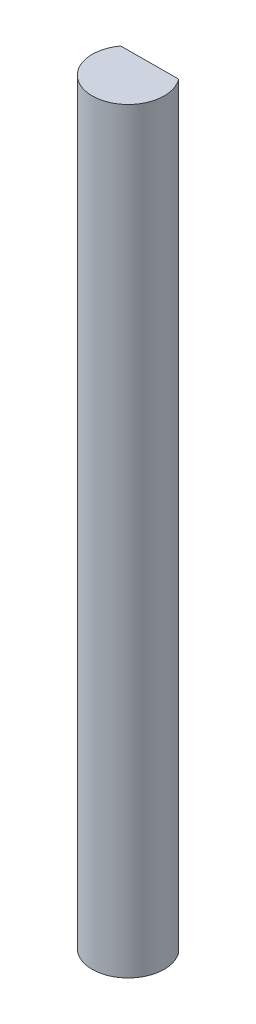
from build123d import *

# Parameters (mm, degrees)
SKETCH1_R           = 3.175
BOSS_EXTRUDE1_DEPTH = 41.275
CUT_EXTRUDE5_DEPTH  = 83.672025196
CUT_EXTRUDE8_DEPTH  = 15.875


with BuildPart() as part:
    # Sketch1 → Boss-Extrude1 (new, symmetric)
    with BuildSketch(Plane(origin=(0, 0, 0), x_dir=(1, 0, 0), z_dir=(0, 1, 0))):
        with Locations(Location((0, 0, 0), (0, 0, 270))):
            Circle(SKETCH1_R)
    extrude(amount=BOSS_EXTRUDE1_DEPTH, both=True)

    # Sketch2 → Cut-Extrude5 (cut, through all)
    with BuildSketch(Plane(origin=(0, 41.275, 0), x_dir=(1, 0, 0), z_dir=(0, 1, 0))):
        with BuildLine():
            Line((-2.549322464, 1.892506268), (2.530677536, 1.917366999))
            ThreePointArc((2.530677536, 1.917366999), (-0.015537771, 3.174961981), (-2.549322464, 1.892506268))
        make_face()
    extrude(amount=-CUT_EXTRUDE5_DEPTH, mode=Mode.SUBTRACT)

    # Sketch5 → Cut-Extrude8 (cut)
    with BuildSketch(Plane(origin=(0, 41.275, 0), x_dir=(1, 0, 0), z_dir=(0, 1, 0))):
        with BuildLine():
            Line((2.530677536, 1.917366999), (-2.549322464, 1.892506268))
            ThreePointArc((-2.549322464, 1.892506268), (0.015537771, -3.174961981), (2.530677536, 1.917366999))
        make_face()
    extrude(amount=-CUT_EXTRUDE8_DEPTH, mode=Mode.SUBTRACT)


solid = part.part
